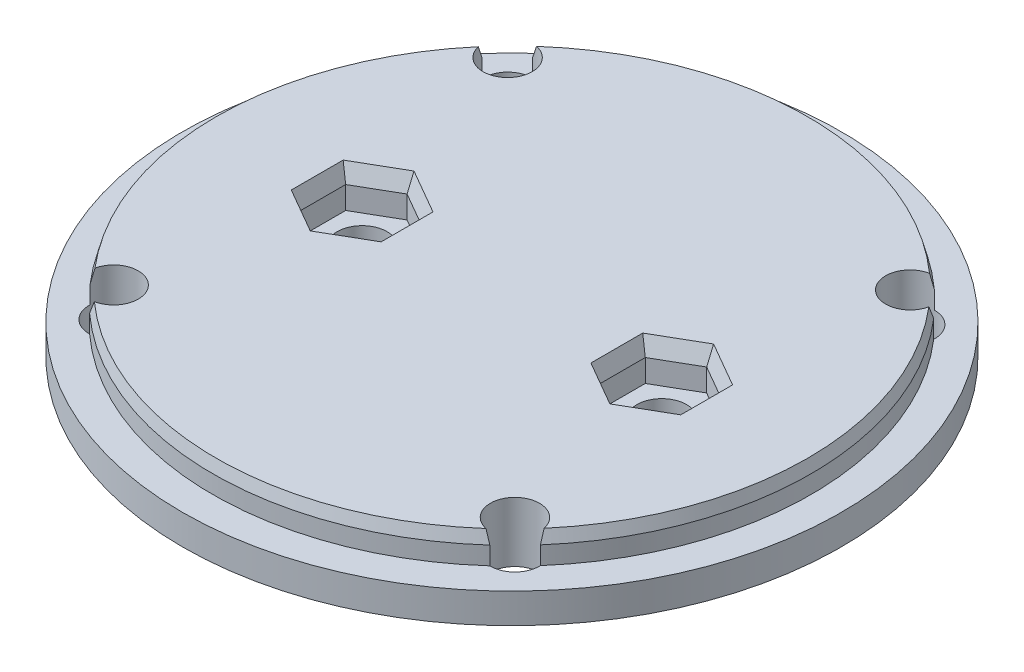
from build123d import *
from OCP.BRepFilletAPI import BRepFilletAPI_MakeChamfer

# Parameters (mm, degrees)
SKETCH_1_R          = 55
EXTRUDE_1_DEPTH     = 5
SKETCH_2_R          = 49.9
EXTRUDE_2_DEPTH     = 5
SKETCH_3_W          = 35
SKETCH_3_H          = 30
EXTRUDE_3_DEPTH     = 25
SKETCH_4_W          = 20.2
SKETCH_4_H          = 10.3
CUT_EXTRUDE_1_DEPTH = 93.466210045
SKETCH_5_R          = 4.1
CUT_EXTRUDE_2_DEPTH = 82.700673192
CHAMFER1_SIZE       = 2
CHAMFER1_SIZE2      = 0.535898385
SKETCH2_W           = 35
SKETCH2_H           = 30
CUT_EXTRUDE1_DEPTH  = 12.5
BOSS_EXTRUDE1_START = -2
SKETCH4_W           = 70
SKETCH4_H           = 20
BOSS_EXTRUDE1_DEPTH = 5.35
SKETCH5_R           = 4.15
CUT_EXTRUDE2_DEPTH  = 80.281917882
CUT_EXTRUDE3_DEPTH  = 6.5
CHAMFER2_SIZE       = 1
CHAMFER2_SIZE2      = 2.747477419


with BuildPart() as part:
    # Эскиз1 → Бобышка-Вытянуть1 (new body)
    with BuildSketch(Plane(origin=(0, 0, 0), x_dir=(1, 0, 0), z_dir=(0, 1, 0))):
        with Locations(Location((0, 0, 0), (0, 0, 270))):
            Circle(SKETCH_1_R)
    extrude(amount=EXTRUDE_1_DEPTH)

    # Эскиз2 → Бобышка-Вытянуть2 (add)
    with BuildSketch(Plane(origin=(0, 5, 0), x_dir=(1, 0, 0), z_dir=(0, 1, 0))):
        with Locations(Location((0, 0, 0), (0, 0, 270))):
            Circle(SKETCH_2_R)
    extrude(amount=EXTRUDE_2_DEPTH)

    # Эскиз3 → Бобышка-Вытянуть3 (add)
    with BuildSketch(Plane.XZ):
        Rectangle(SKETCH_3_W, SKETCH_3_H)
    extrude(amount=EXTRUDE_3_DEPTH)

    # Эскиз4 → Вырез-Вытянуть1 (cut, through all)
    with BuildSketch(Plane.XY.offset(15)):
        with Locations((0, -12.5)):
            Rectangle(SKETCH_4_W, SKETCH_4_H)
    extrude(amount=-CUT_EXTRUDE_1_DEPTH, mode=Mode.SUBTRACT)

    # Эскиз5 → Вырез-Вытянуть2 (cut, through all)
    with BuildSketch(Plane.XZ):
        with Locations(Location((33.592198598, -32.871936263, 0), (0, 0, 270))):
            Circle(SKETCH_5_R)
        with Locations(Location((-33.591727056, -32.872418125, 0), (0, 0, 270))):
            Circle(SKETCH_5_R)
        with Locations(Location((-33.591727056, 32.872418125, 0), (0, 0, 270))):
            Circle(SKETCH_5_R)
        with Locations(Location((33.483215177, 32.983215177, 0), (0, 0, 270))):
            Circle(SKETCH_5_R)
    extrude(amount=-CUT_EXTRUDE_2_DEPTH, mode=Mode.SUBTRACT)

    # Chamfer1: one chamfer whose edges measure the first distance from different faces: ONE call of the kernel's chamfer builder (chamfer() names one face for all edges)
    chamfer1_edges_1 = [part.edges().sort_by_distance(p)[0] for p in [
        (0.000357897, 10, -49.899999999),
    ]]
    chamfer1_side_1 = [part.faces().sort_by_distance(p)[0] for p in [
        (0.000357897, 7.5, -49.899999999),
    ]]
    chamfer1_edges_2 = [part.edges().sort_by_distance(p)[0] for p in [
        (-49.9, 10, 0),
    ]]
    chamfer1_side_2 = [part.faces().sort_by_distance(p)[0] for p in [
        (-49.9, 7.5, 0),
    ]]
    chamfer1_edges_3 = [part.edges().sort_by_distance(p)[0] for p in [
        (-0.08242255, 10, 49.899931929),
    ]]
    chamfer1_side_3 = [part.faces().sort_by_distance(p)[0] for p in [
        (-0.08242255, 7.5, 49.899931929),
    ]]
    chamfer1_edges_4 = [part.edges().sort_by_distance(p)[0] for p in [
        (49.899931657, 10, 0.082587101),
    ]]
    chamfer1_side_4 = [part.faces().sort_by_distance(p)[0] for p in [
        (49.899931657, 7.5, 0.082587101),
    ]]
    chamfer1 = BRepFilletAPI_MakeChamfer(part.part.solid().wrapped)
    for e in chamfer1_edges_1:
        chamfer1.Add(CHAMFER1_SIZE, CHAMFER1_SIZE2, e.wrapped, chamfer1_side_1[0].wrapped)  # the first distance lies on this face
    for e in chamfer1_edges_2:
        chamfer1.Add(CHAMFER1_SIZE, CHAMFER1_SIZE2, e.wrapped, chamfer1_side_2[0].wrapped)  # the first distance lies on this face
    for e in chamfer1_edges_3:
        chamfer1.Add(CHAMFER1_SIZE, CHAMFER1_SIZE2, e.wrapped, chamfer1_side_3[0].wrapped)  # the first distance lies on this face
    for e in chamfer1_edges_4:
        chamfer1.Add(CHAMFER1_SIZE, CHAMFER1_SIZE2, e.wrapped, chamfer1_side_4[0].wrapped)  # the first distance lies on this face
    add(Compound.cast(chamfer1.Shape()), mode=Mode.REPLACE)

    # Sketch2 → Cut-Extrude1 (cut)
    with BuildSketch(Plane.XZ.offset(25)):
        Rectangle(SKETCH2_W, SKETCH2_H)
    extrude(amount=-CUT_EXTRUDE1_DEPTH, mode=Mode.SUBTRACT)

    # Sketch4 → Boss-Extrude1 (add)
    with BuildSketch(Plane.XZ.offset(7.35).offset(BOSS_EXTRUDE1_START)):
        Rectangle(SKETCH4_W, SKETCH4_H)
    extrude(amount=-BOSS_EXTRUDE1_DEPTH)

    # Sketch5 → Cut-Extrude2 (cut, through all)
    with BuildSketch(Plane.XZ.offset(5.35)):
        with Locations((25, 0)):
            Circle(SKETCH5_R)
        with Locations((-25, 0)):
            Circle(SKETCH5_R)
    extrude(amount=-CUT_EXTRUDE2_DEPTH, mode=Mode.SUBTRACT)

    # Sketch6 → Cut-Extrude3 (cut)
    with BuildSketch(Plane(origin=(0, 10, 0), x_dir=(1, 0, 0), z_dir=(0, 1, 0))):
        Polygon((-18.504809472, 3.75), (-25, 7.5), (-31.495190528, 3.75), (-31.495190528, -3.75), (-25, -7.5), (-18.504809472, -3.75), align=None)
        Polygon((31.495190528, 3.75), (25, 7.5), (18.504809472, 3.75), (18.504809472, -3.75), (25, -7.5), (31.495190528, -3.75), align=None)
    extrude(amount=-CUT_EXTRUDE3_DEPTH, mode=Mode.SUBTRACT)

    # Chamfer2
    chamfer2_edges = [part.edges().sort_by_distance(p)[0] for p in [
        (-18.504809472, 10, 0),
        (-21.752404736, 10, -5.625),
        (-28.247595264, 10, -5.625),
        (-31.495190528, 10, 0),
        (-28.247595264, 10, 5.625),
        (-21.752404736, 10, 5.625),
        (31.495190528, 10, 0),
        (28.247595264, 10, -5.625),
        (21.752404736, 10, -5.625),
        (18.504809472, 10, 0),
        (21.752404736, 10, 5.625),
        (28.247595264, 10, 5.625),
    ]]
    chamfer2_side = [part.faces().sort_by_distance(p)[0] for p in [
        (0.000665728, 10, -0.000672626),
    ]]
    chamfer(chamfer2_edges, length=CHAMFER2_SIZE, length2=CHAMFER2_SIZE2, reference=chamfer2_side[0])


solid = part.part
